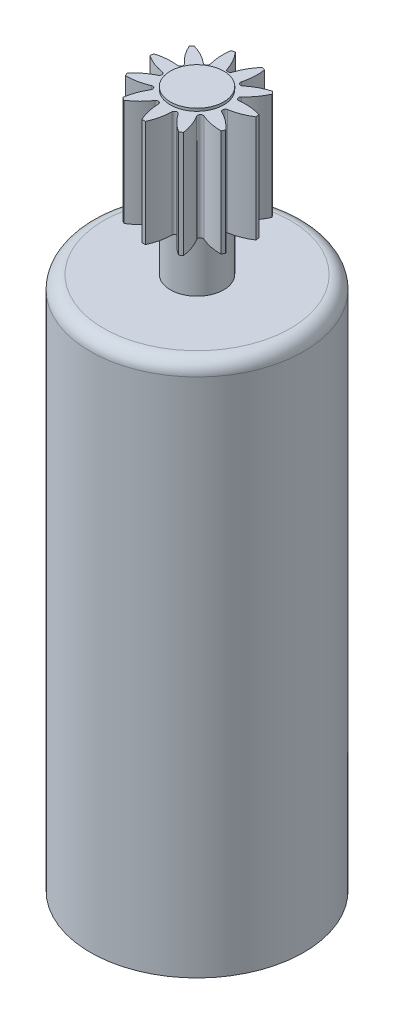
from build123d import *

# Parameters (mm, degrees)
CUT_EXTRUDE1_START = -6
CUT_EXTRUDE1_DEPTH = 6
CIRPATTERN1_COUNT  = 11


with BuildPart() as part:
    # Sketch2 → Revolve1 (revolve)
    with BuildSketch(Plane.XY, mode=Mode.PRIVATE) as revolve1_sk:
        with BuildLine():
            Line((0, 0), (0, 26.1))
            Line((0, 26.1), (1, 26.1))
            Line((1, 26.1), (1, 26))
            Line((1, 26), (2, 26))
            Line((2, 26), (2, 22))
            Line((2, 22), (1, 22))
            Line((1, 22), (1, 20))
            Line((1, 20), (3.5, 20))
            ThreePointArc((3.5, 20), (3.853553391, 19.853553391), (4, 19.5))
            Line((4, 19.5), (4, 0))
            Line((4, 0), (0, 0))
        make_face()
    revolve(revolve1_sk.sketch.rotate(Axis((0, 0, 0), (0, 1, 0)), 90), axis=Axis((0, 0, 0), (0, 1, 0)))

    # Sketch3 → Cut-Extrude1 (cut)
    with BuildSketch(Plane(origin=(0, 26, 0), x_dir=(1, 0, 0), z_dir=(0, 1, 0)).offset(CUT_EXTRUDE1_START)):
        with BuildLine():
            Line((0, 2), (0, 1.15))
            ThreePointArc((0, 1.15), (0.059077059, 1.169316042), (0.095331419, 1.219801979))
            ThreePointArc((0.095331419, 1.219801979), (0.260400333, 1.599188187), (0.5, 1.936491673))
            ThreePointArc((0.5, 1.936491673), (0.252008585, 1.984059393), (0, 2))
        make_face()
        with BuildLine():
            ThreePointArc((-0.095331419, 1.219801979), (-0.059077059, 1.169316042), (0, 1.15))
            Line((0, 1.15), (0, 2))
            ThreePointArc((0, 2), (-0.252008585, 1.984059393), (-0.5, 1.936491673))
            ThreePointArc((-0.5, 1.936491673), (-0.260400333, 1.599188187), (-0.095331419, 1.219801979))
        make_face()
    cut_extrude1 = extrude(amount=CUT_EXTRUDE1_DEPTH, mode=Mode.SUBTRACT)

    # CirPattern1: Cut-Extrude1 ×11 about axis
    cirpattern1_axis = Axis((0, 0, 0), (0, 1, 0))
    for i in range(1, CIRPATTERN1_COUNT):
        add(cut_extrude1.rotate(cirpattern1_axis, i * 360 / CIRPATTERN1_COUNT), mode=Mode.SUBTRACT)


solid = part.part
